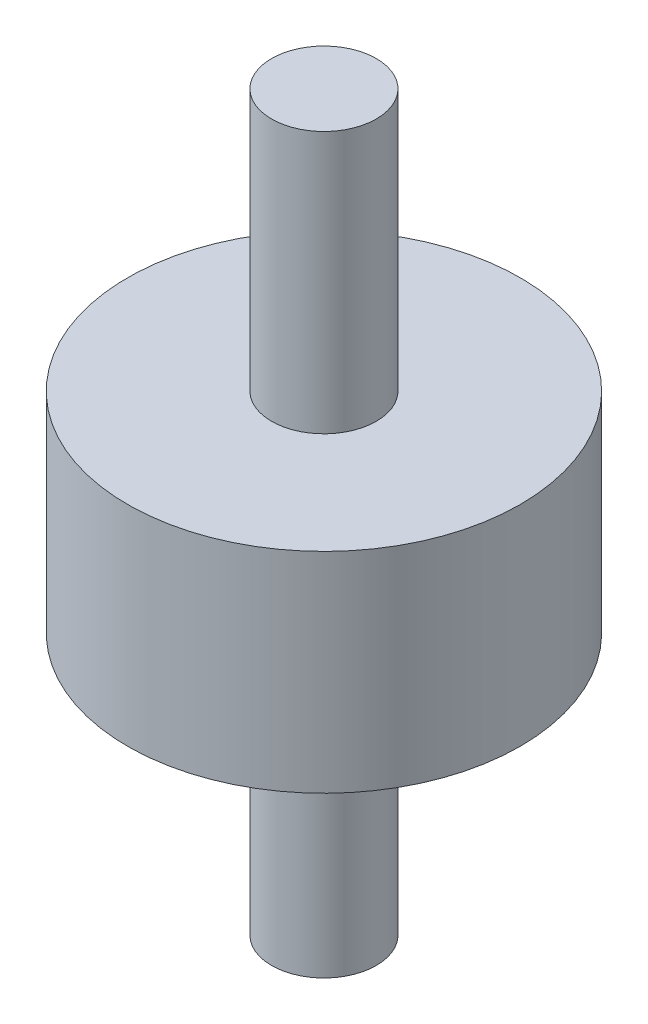
from build123d import *


with BuildPart() as part:
    # Sketch1 → Revolve1 (revolve)
    with BuildSketch(Plane.XY, mode=Mode.PRIVATE) as revolve1_sk:
        Polygon((0, 28), (-2, 28), (-2, 18), (-7.5, 18), (-7.5, 10), (-2, 10), (-2, 0), (0, 0), align=None)
    revolve(revolve1_sk.sketch.rotate(Axis((0, 0, 0), (0, 1, 0)), 180), axis=Axis((0, 0, 0), (0, 1, 0)))


solid = part.part
